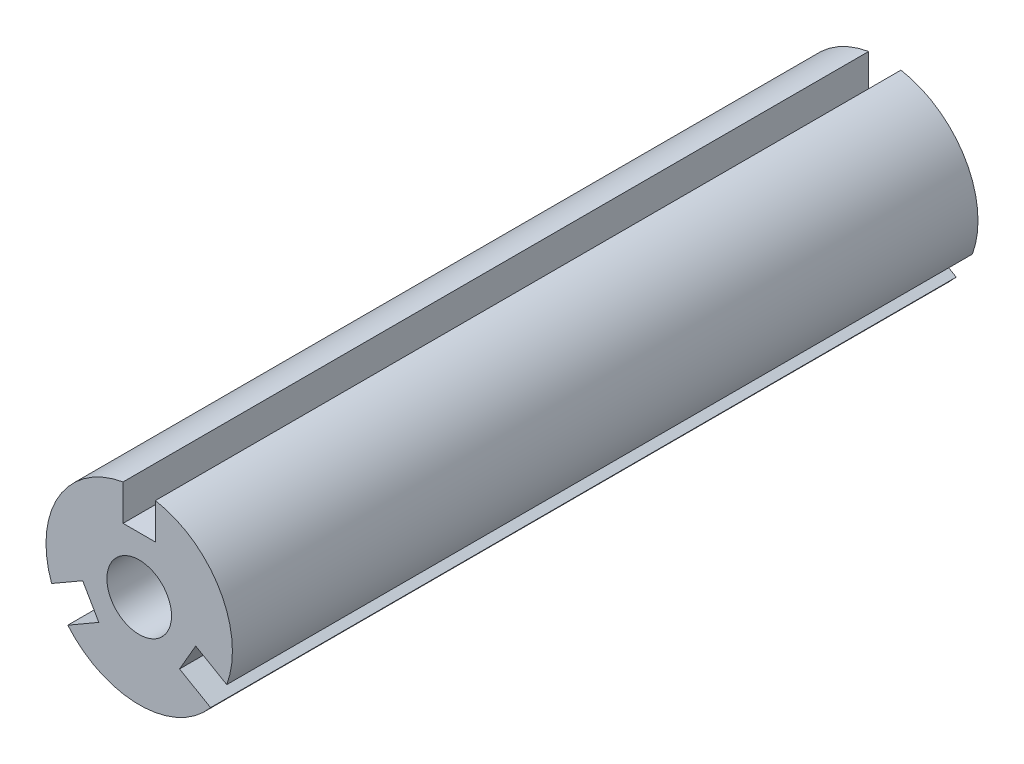
from build123d import *

# Parameters (mm, degrees)
ESTRUSIONE_ESTRUSIONE1_DEPTH = 60
SCHIZZO2_R                   = 2.6
TAGLIO_ESTRUSIONE1_DEPTH     = 60
SCHIZZO3_R                   = 2.4
TAGLIO_ESTRUSIONE2_DEPTH     = 10


with BuildPart() as part:
    # Schizzo1 → Estrusione-Estrusione1 (new body)
    with BuildSketch(Plane.XY):
        with BuildLine():
            Line((7.046874237, -2.567404038), (4.547114317, -1.124166975))
            Line((4.547114317, -1.124166975), (3.247114317, -3.375833025))
            Line((3.247114317, -3.375833025), (5.746874237, -4.819070087))
            ThreePointArc((5.746874237, -4.819070087), (0, -7.5), (-5.746874237, -4.819070087))
            Line((-5.746874237, -4.819070087), (-3.247114317, -3.375833025))
            Line((-3.247114317, -3.375833025), (-4.547114317, -1.124166975))
            Line((-4.547114317, -1.124166975), (-7.046874237, -2.567404038))
            ThreePointArc((-7.046874237, -2.567404038), (-6.495190528, 3.75), (-1.3, 7.386474125))
            Line((-1.3, 7.386474125), (-1.3, 4.5))
            Line((-1.3, 4.5), (1.3, 4.5))
            Line((1.3, 4.5), (1.3, 7.386474125))
            ThreePointArc((1.3, 7.386474125), (6.495190528, 3.75), (7.046874237, -2.567404038))
        make_face()
    extrude(amount=ESTRUSIONE_ESTRUSIONE1_DEPTH)

    # Schizzo2 → Taglio-Estrusione1 (cut)
    with BuildSketch(Plane.XY.offset(60)):
        Circle(SCHIZZO2_R)
    extrude(amount=-TAGLIO_ESTRUSIONE1_DEPTH, mode=Mode.SUBTRACT)

    # Schizzo3 → Taglio-Estrusione2 (cut)
    with BuildSketch(Plane(origin=(0, 0, 0), x_dir=(1, 0, 0), z_dir=(0, 1, 0))):
        with Locations(Location((0, -30, 0), (0, 0, 270))):
            Circle(SCHIZZO3_R)
    extrude(amount=-TAGLIO_ESTRUSIONE2_DEPTH, mode=Mode.SUBTRACT)


solid = part.part
